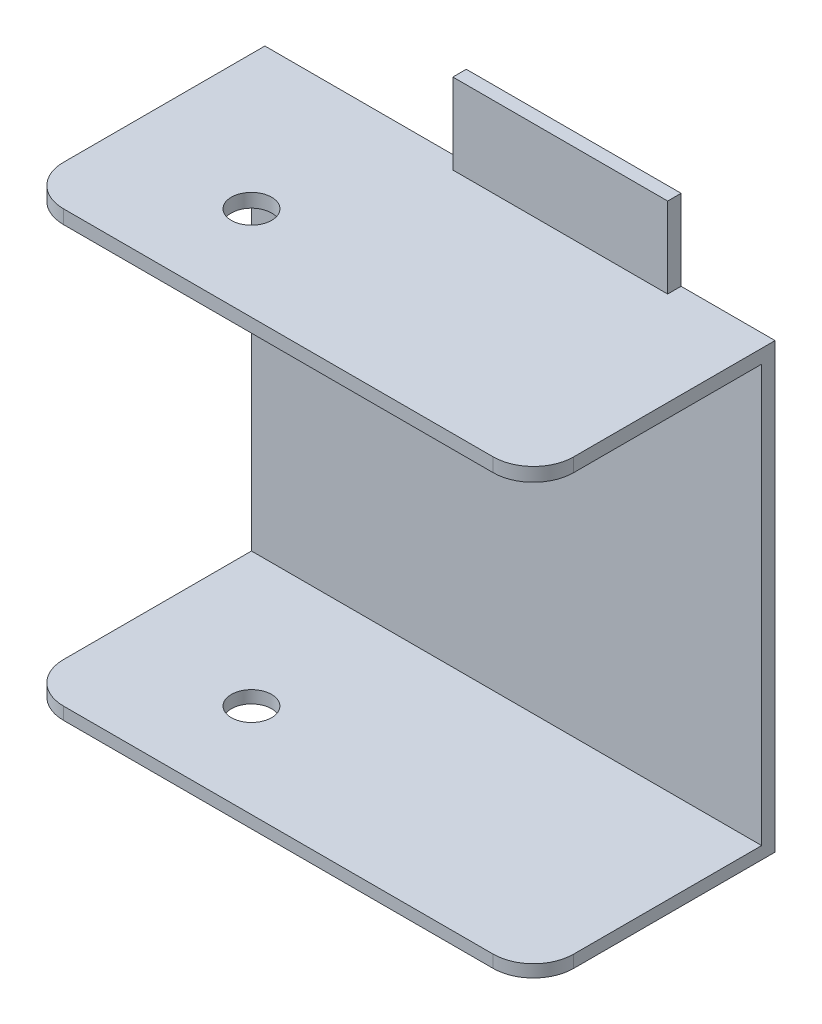
from build123d import *

# Parameters (mm, degrees)
EXTRUSION1_DEPTH        = 1
ESQUISSE14_W            = 38
ESQUISSE14_H            = 1.021269028
ESQUISSE14_H_2          = 0.92452696
EXTRUSION2_DEPTH        = 17
CONG_3_R                = 3
ESQUISSE20_R            = 1.551729924
ESQUISSE20_R_2          = 1.5
ENL_V_MAT_EXTRU_7_DEPTH = 46


with BuildPart() as part:
    # Esquisse1 → Extrusion1 (new body)
    with BuildSketch(Plane.XY):
        Polygon((-30.989172535, 10.739018032), (-30.989172535, -22.260981968), (-37.989172535, -22.260981968), (-37.989172535, -28.260981968), (-53.989172535, -28.260981968), (-53.989172535, -22.260981968), (-68.989172535, -22.260981968), (-68.989172535, 10.739018032), (-53.989172535, 10.739018032), (-53.989172535, 16.739018032), (-37.989172535, 16.739018032), (-37.989172535, 10.739018032), align=None)
    extrude(amount=EXTRUSION1_DEPTH)

    # Esquisse14 → Extrusion2 (add)
    with BuildSketch(Plane.XY.offset(1)):
        with Locations((-49.989172535, 10.228383518)):
            Rectangle(ESQUISSE14_W, ESQUISSE14_H)
        with Locations((-49.989172535, -21.798718488)):
            Rectangle(ESQUISSE14_W, ESQUISSE14_H_2)
    extrude(amount=EXTRUSION2_DEPTH)

    # Congé3
    cong_3_edges = [part.edges().sort_by_distance(p)[0] for p in [
        (-68.989172535, -21.798718488, 18),
        (-30.989172535, -21.798718488, 18),
        (-30.989172535, 10.228383518, 18),
        (-68.989172535, 10.228383518, 18),
    ]]
    fillet(cong_3_edges, radius=CONG_3_R)

    # Esquisse20 → Enlèv. mat.-Extru.7 (cut)
    with BuildSketch(Plane(origin=(0, 10.739018032, 0), x_dir=(-1, 0, 0), z_dir=(0, 1, 0))):
        with Locations((109.664285954, 11.585691392)):
            Circle(ESQUISSE20_R)
        with Locations(Location((58.989172535, 11, 0), (0, 0, 90))):
            Circle(ESQUISSE20_R_2)
    extrude(amount=-ENL_V_MAT_EXTRU_7_DEPTH, mode=Mode.SUBTRACT)


solid = part.part
